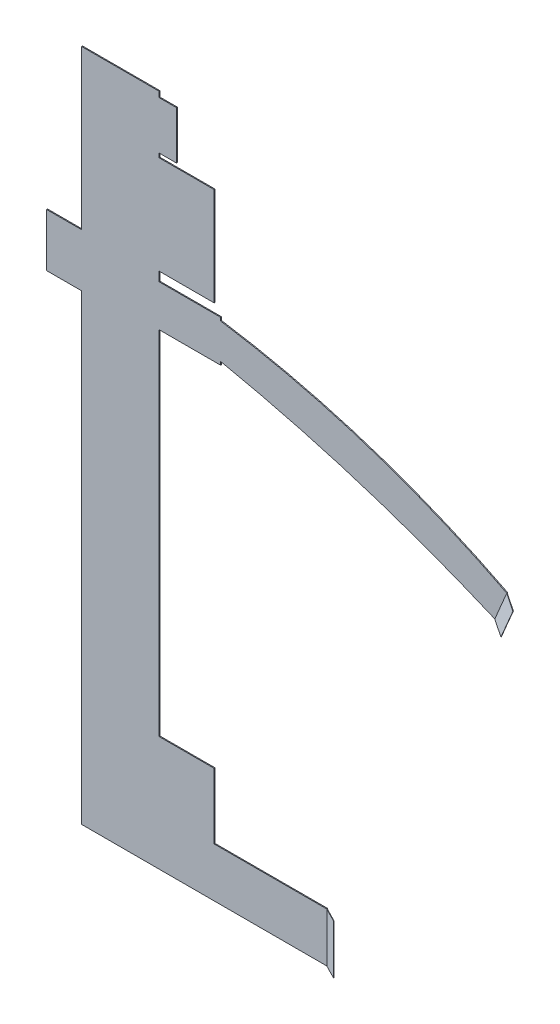
from build123d import *

# Parameters (mm, degrees)
SKETCH_1_W      = 19
SKETCH_1_H      = 52
SKETCH_1_W_2    = 60
SKETCH_1_H_2    = 29.5
SKETCH_1_H_3    = 41.5
SKETCH_1_H_4    = 49.5
SKETCH_1_H_5    = 60
SKETCH_1_H_6    = 106.4
SKETCH_1_H_7    = 111
SKETCH_1_H_8    = 112
SKETCH_1_H_9    = 113
SKETCH_1_H_10   = 116.5
EXTRUDE_1_DEPTH = 1
EXTRUDE_2_DEPTH = 53.5
EXTRUDE_3_DEPTH = 33.4


with BuildPart() as part:
    # 草图1 → 拉伸1 (new body)
    with BuildSketch(Plane.XY.offset(42)):
        with Locations((858.7, -476.2)):
            Rectangle(SKETCH_1_W, SKETCH_1_H)
        with Locations((879.2, -1106.35)):
            Rectangle(SKETCH_1_W_2, SKETCH_1_H_2)
        with Locations((879.2, -1070.85)):
            Rectangle(SKETCH_1_W_2, SKETCH_1_H_3)
        with Locations((795.5, -1149.85)):
            Rectangle(SKETCH_1_W_2, SKETCH_1_H_4)
        with Locations((795.5, -474.2)):
            Rectangle(SKETCH_1_W_2, SKETCH_1_H_5)
        with Locations((879.2, -559.9)):
            Rectangle(SKETCH_1_W_2, SKETCH_1_H_6)
        with Locations((795.5, -953.1)):
            Rectangle(SKETCH_1_W_2, SKETCH_1_H_7)
        with Locations((795.5, -842.1)):
            Rectangle(SKETCH_1_W_2, SKETCH_1_H_7)
        with Locations((795.5, -560.2)):
            Rectangle(SKETCH_1_W_2, SKETCH_1_H_8)
        with Locations((795.5, -730.1)):
            Rectangle(SKETCH_1_W_2, SKETCH_1_H_9)
        with Locations((795.5, -1066.85)):
            Rectangle(SKETCH_1_W_2, SKETCH_1_H_10)
        Polygon((1031.2, -1174.6), (1031.2, -1121.1), (909.2, -1121.1), (849.2, -1121.1), (849.2, -1174.6), align=None)
        with BuildLine():
            Line((1213.4, -757.7), (1226.4, -727))
            ThreePointArc((1226.4, -727), (1075.34720829, -664.295577574), (916.2, -626.6))
            Line((916.2, -626.6), (916.2, -623.1))
            Line((916.2, -623.1), (849.2, -623.1))
            Line((849.2, -623.1), (849.2, -668.1))
            Line((849.2, -668.1), (916.2, -668.1))
            Line((916.2, -668.1), (916.2, -664.6))
            ThreePointArc((916.2, -664.6), (1067.153405165, -703.637303814), (1213.4, -757.7))
        make_face()
        Polygon((849.2, -450.2), (849.2, -444.2), (825.5, -444.2), (825.5, -504.2), (825.5, -616.2), (765.5, -616.2), (727.5, -616.2), (727.5, -673.6), (765.5, -673.6), (825.5, -673.6), (825.5, -786.6), (825.5, -897.6), (825.5, -1008.6), (825.5, -1125.1), (825.5, -1174.6), (849.2, -1174.6), (849.2, -1121.1), (849.2, -1091.6), (849.2, -1050.1), (849.2, -681.1), (849.2, -668.1), (849.2, -623.1), (849.2, -613.1), (849.2, -506.7), (849.2, -502.2), align=None)
    extrude(amount=-EXTRUDE_1_DEPTH)

    # 草图2 → 拉伸2 (add)
    with BuildSketch(Plane.XZ.offset(1174.6)):
        Polygon((1031.2, 42), (1046.2, 49.648642972), (1046.2, 49.148642972), (1031.2, 41.5), align=None)
    extrude(amount=-EXTRUDE_2_DEPTH)

    # 草图3 → 拉伸3 (add)
    with BuildSketch(Plane(origin=(1226.4, -727, 42), x_dir=(-0.9208430096491422, 0.38993352200126363, 0), z_dir=(0.38993352200126363, 0.9208430096491422, 0))):
        Polygon((0, -0.5), (-15.5, 7.15), (-15.5, 7.65), (0, 0), align=None)
    extrude(amount=-EXTRUDE_3_DEPTH)


solid = part.part
